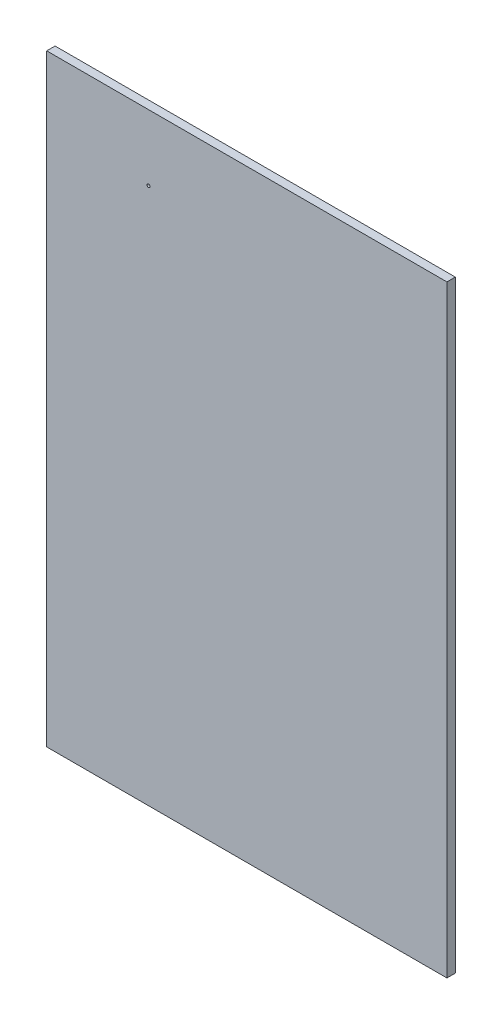
from build123d import *

# Parameters (mm, degrees)
SKETCH1_W           = 1200
SKETCH1_H           = 1800
BOSS_EXTRUDE1_DEPTH = 25
SKETCH2_R           = 4.5
CUT_EXTRUDE1_DEPTH  = 1082.954250419
SKETCH5_W           = 1918.317886643
SKETCH5_H           = 2614.541366737
CUT_EXTRUDE2_DEPTH  = 5


with BuildPart() as part:
    # Sketch1 → Boss-Extrude1 (new body)
    with BuildSketch(Plane.XY):
        Rectangle(SKETCH1_W, SKETCH1_H)
    extrude(amount=BOSS_EXTRUDE1_DEPTH)

    # Sketch2 → Cut-Extrude1 (cut, through all)
    with BuildSketch(Plane.XY.offset(25)):
        with Locations((-296, 703)):
            Circle(SKETCH2_R)
    extrude(amount=-CUT_EXTRUDE1_DEPTH, mode=Mode.SUBTRACT)

    # Sketch5 → Cut-Extrude2 (cut)
    with BuildSketch(Plane(origin=(600, 0, 0), x_dir=(0, 0, -1), z_dir=(1, 0, 0))):
        with Locations((50.456378519, -72.831888875)):
            Rectangle(SKETCH5_W, SKETCH5_H)
    extrude(amount=-CUT_EXTRUDE2_DEPTH, mode=Mode.SUBTRACT)


solid = part.part
